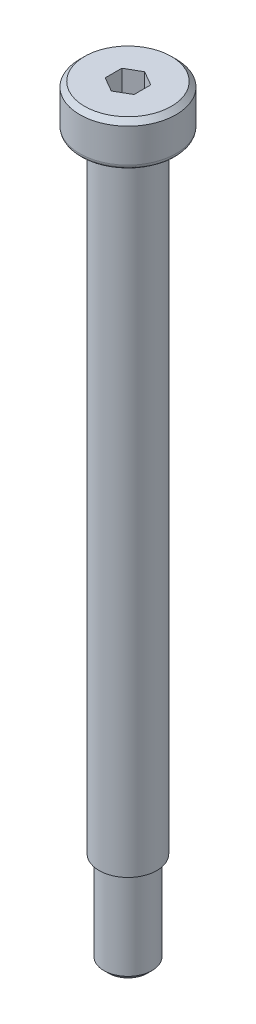
from build123d import *

# Parameters (mm, degrees)
CUT_EXTRUDE1_DEPTH = 2.5
CHAMFER1_SIZE      = 0.5
FILLET1_R          = 0.5
CHAMFER2_SIZE      = 0.5


with BuildPart() as part:
    # Sketch1 → Revolve1 (revolve)
    with BuildSketch(Plane.XY, mode=Mode.PRIVATE) as revolve1_sk:
        Polygon((0, 0), (5, 0), (5, -4.5), (2.75, -4.5), (2.75, -4.75), (3, -4.75), (3, -69.5), (2.5, -69.5), (2.5, -79.25), (0, -79.25), align=None)
    revolve(revolve1_sk.sketch.rotate(Axis((0, 5, 0), (0, -1, 0)), 180), axis=Axis((0, 5, 0), (0, -1, 0)))

    # Sketch2 → Cut-Extrude1 (cut)
    with BuildSketch(Plane(origin=(0, 0, 0), x_dir=(1, 0, 0), z_dir=(0, 1, 0))):
        Polygon((0, -1.732050808), (1.5, -0.866025404), (1.5, 0.866025404), (0, 1.732050808), (-1.5, 0.866025404), (-1.5, -0.866025404), align=None)
    extrude(amount=-CUT_EXTRUDE1_DEPTH, mode=Mode.SUBTRACT)

    # Chamfer1
    chamfer1_edges = [part.edges().sort_by_distance(p)[0] for p in [
        (5, 0, 0),
    ]]
    chamfer(chamfer1_edges, length=CHAMFER1_SIZE)

    # Fillet1
    fillet1_edges = [part.edges().sort_by_distance(p)[0] for p in [
        (5, -4.5, 0),
    ]]
    fillet(fillet1_edges, radius=FILLET1_R)

    # Chamfer2
    chamfer2_edges = [part.edges().sort_by_distance(p)[0] for p in [
        (2.5, -79.25, 0),
    ]]
    chamfer(chamfer2_edges, length=CHAMFER2_SIZE)


solid = part.part
